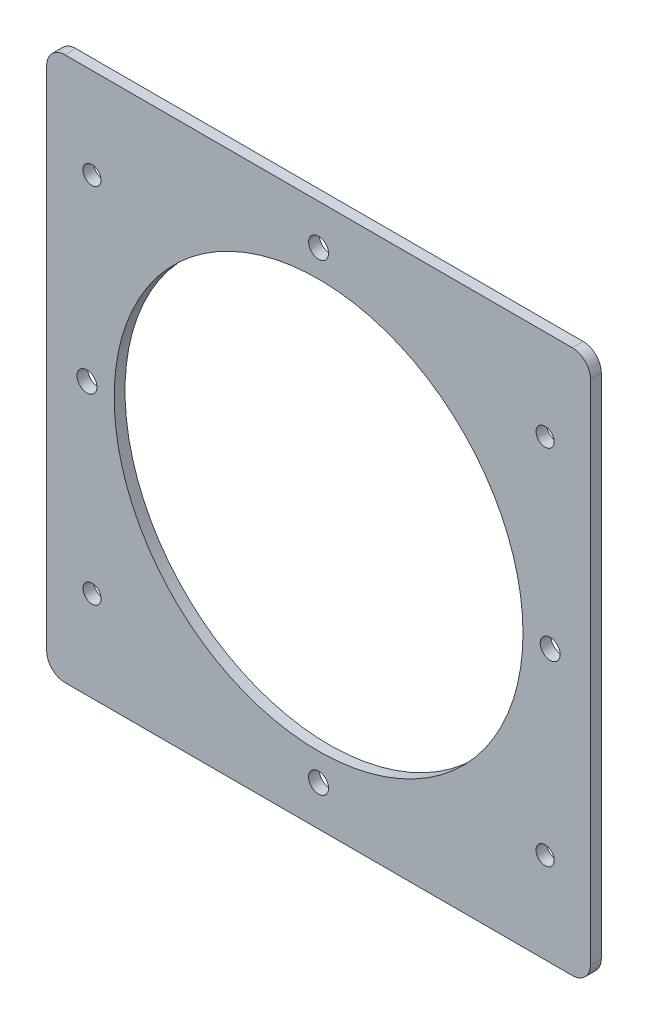
from build123d import *

# Parameters (mm, degrees)
SKETCH1_W               = 150
SKETCH1_H               = 150
BOSS_EXTRUDE1_DEPTH     = 1.5
CUT_EXTRUDE1_DEPTH      = 107.076623249
CUT_EXTRUDE1_DEPTH_BACK = 107.076623249
SKETCH2_R               = 2.75
CUT_EXTRUDE2_DEPTH      = 107.076623249
CUT_EXTRUDE2_DEPTH_BACK = 107.076623249
CUT_EXTRUDE3_DEPTH      = 107.076623249
CUT_EXTRUDE3_DEPTH_BACK = 107.076623249
SKETCH4_R               = 2.5
FILLET1_R               = 5


with BuildPart() as part:
    # Sketch1 → Boss-Extrude1 (new, symmetric)
    with BuildSketch(Plane.XY):
        Rectangle(SKETCH1_W, SKETCH1_H)
    extrude(amount=BOSS_EXTRUDE1_DEPTH, both=True)

    # Sketch2 → Cut-Extrude1 (cut, two sides: drawn at the far end of the back side and taken through both)
    with BuildSketch(Plane.XY.offset(-CUT_EXTRUDE1_DEPTH_BACK)):
        with Locations((0, 63.9)):
            Circle(SKETCH2_R)
        with Locations((63.9, 0)):
            Circle(SKETCH2_R)
        with Locations((0, -63.9)):
            Circle(SKETCH2_R)
        with Locations((-63.9, 0)):
            Circle(SKETCH2_R)
    extrude(amount=CUT_EXTRUDE1_DEPTH + CUT_EXTRUDE1_DEPTH_BACK, mode=Mode.SUBTRACT)

    # Sketch3 → Cut-Extrude2 (cut, two sides: drawn at the far end of the back side and taken through both)
    with BuildSketch(Plane.XY.offset(-CUT_EXTRUDE2_DEPTH_BACK)):
        with BuildLine():
            ThreePointArc((-56, -6.705221846), (0, -56.4), (56, -6.705221846))
            ThreePointArc((56, -6.705221846), (0, 56.4), (-56, -6.705221846))
        make_face()
    extrude(amount=CUT_EXTRUDE2_DEPTH + CUT_EXTRUDE2_DEPTH_BACK, mode=Mode.SUBTRACT)

    # Sketch4 → Cut-Extrude3 (cut, two sides: drawn at the far end of the back side and taken through both)
    with BuildSketch(Plane.XY.offset(-CUT_EXTRUDE3_DEPTH_BACK)):
        with Locations((-62.5, 50)):
            Circle(SKETCH4_R)
        with Locations(Location((-62.5, -50, 0), (0, 0, 180))):
            Circle(SKETCH4_R)
        with Locations((62.5, -50)):
            Circle(SKETCH4_R)
        with Locations(Location((62.5, 50, 0), (0, 0, 180))):
            Circle(SKETCH4_R)
    extrude(amount=CUT_EXTRUDE3_DEPTH + CUT_EXTRUDE3_DEPTH_BACK, mode=Mode.SUBTRACT)

    # Fillet1
    fillet1_edges = [part.edges().sort_by_distance(p)[0] for p in [
        (75, -75, 0),
        (-75, -75, 0),
        (-75, 75, 0),
        (75, 75, 0),
    ]]
    fillet(fillet1_edges, radius=FILLET1_R)


solid = part.part
